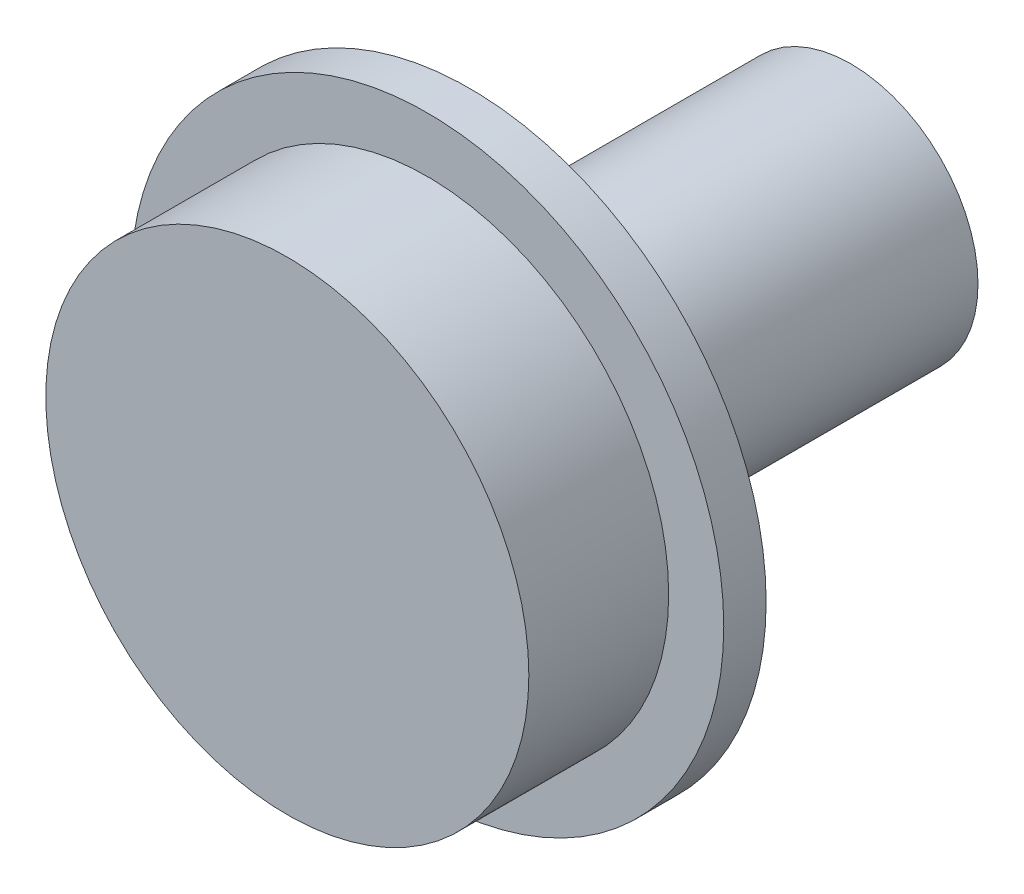
from build123d import *

# Parameters (mm, degrees)
LOW_START                          = 0.5
LOW_SCREW_HEAD_PROFILE_R           = 2.85
LOW_SCREW_HEAD_DEPTH               = 1.65
M3_START                           = -4.5
M3_SHANK_THREADS_OMITTED_PROFILE_R = 1.5
M3_SHANK_THREADS_OMITTED_DEPTH     = 5
M3_WASHER_ENVELOPE_PROFILE_R       = 3.5
M3_WASHER_ENVELOPE_PROFILE_R_2     = 1.7
M3_WASHER_ENVELOPE_DEPTH           = 0.5


with BuildPart() as part:
    # Low screw head profile → Low screw head (new body)
    with BuildSketch(Plane.XY.offset(LOW_START)):
        Circle(LOW_SCREW_HEAD_PROFILE_R)
    extrude(amount=LOW_SCREW_HEAD_DEPTH)

    # M3 shank, threads omitted profile → M3 shank, threads omitted (add)
    with BuildSketch(Plane.XY.offset(M3_START)):
        Circle(M3_SHANK_THREADS_OMITTED_PROFILE_R)
    extrude(amount=M3_SHANK_THREADS_OMITTED_DEPTH)

    # M3 washer envelope profile → M3 washer envelope (add)
    with BuildSketch(Plane.XY):
        Circle(M3_WASHER_ENVELOPE_PROFILE_R)
        Circle(M3_WASHER_ENVELOPE_PROFILE_R_2, mode=Mode.SUBTRACT)
    extrude(amount=M3_WASHER_ENVELOPE_DEPTH)


solid = part.part
